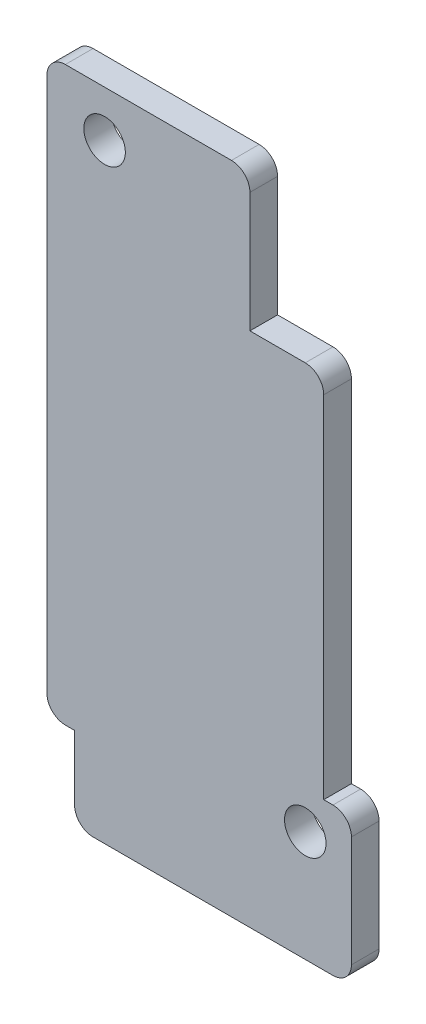
from build123d import *

# Parameters (mm, degrees)
SKETCH1_W            = 30
SKETCH1_H            = 71
BOSS_EXTRUDE1_DEPTH  = 1.5
SKETCH3_W            = 8
SKETCH3_H            = 15
CUT_EXTRUDE1_DEPTH   = 58.341547982
SKETCH6_W            = 3
SKETCH6_H            = 16
BOSS_EXTRUDE2_DEPTH  = 3
M4_CLEARANCE_HOLE1_D = 4.5
SKETCH9_W            = 3
SKETCH9_H            = 9
CUT_EXTRUDE2_DEPTH   = 59.247041392
FILLET1_R            = 2


with BuildPart() as part:
    # Sketch1 → Boss-Extrude1 (new, symmetric)
    with BuildSketch(Plane.XY):
        with Locations((0.944117647, -19.498529412)):
            Rectangle(SKETCH1_W, SKETCH1_H)
    extrude(amount=BOSS_EXTRUDE1_DEPTH, both=True)

    # Sketch3 → Cut-Extrude1 (cut, through all)
    with BuildSketch(Plane.XY.offset(1.5)):
        with Locations((11.944117647, 8.501470588)):
            Rectangle(SKETCH3_W, SKETCH3_H)
    extrude(amount=-CUT_EXTRUDE1_DEPTH, mode=Mode.SUBTRACT)

    # Sketch6 → Boss-Extrude2 (add)
    with BuildSketch(Plane(origin=(15.944117647, 0, 0), x_dir=(0, 0, -1), z_dir=(1, 0, 0))):
        with Locations((0, -46.998529412)):
            Rectangle(SKETCH6_W, SKETCH6_H)
    extrude(amount=BOSS_EXTRUDE2_DEPTH)

    # M4 Clearance Hole1 (through all)
    with Locations(Plane(origin=(0, 0, -1.5), x_dir=(-1, 0, 0), z_dir=(0, 0, -1))):
        with Locations((7.805882353, 11.001470588), (-13.944117647, -42.998529412)):
            Hole(M4_CLEARANCE_HOLE1_D / 2)

    # Sketch9 → Cut-Extrude2 (cut, through all)
    with BuildSketch(Plane(origin=(0, 0, -1.5), x_dir=(-1, 0, 0), z_dir=(0, 0, -1))):
        with Locations((12.555882353, -50.498529412)):
            Rectangle(SKETCH9_W, SKETCH9_H)
    extrude(amount=-CUT_EXTRUDE2_DEPTH, mode=Mode.SUBTRACT)

    # Fillet1
    fillet1_edges = [part.edges().sort_by_distance(p)[0] for p in [
        (15.944117647, 1.001470588, 0),
        (7.944117647, 16.001470588, 0),
        (18.944117647, -38.998529412, 0),
        (18.944117647, -54.998529412, 0),
        (-14.055882353, -45.998529412, 0),
        (-11.055882353, -54.998529412, 0),
        (-14.055882353, 16.001470588, 0),
    ]]
    fillet(fillet1_edges, radius=FILLET1_R)


solid = part.part
